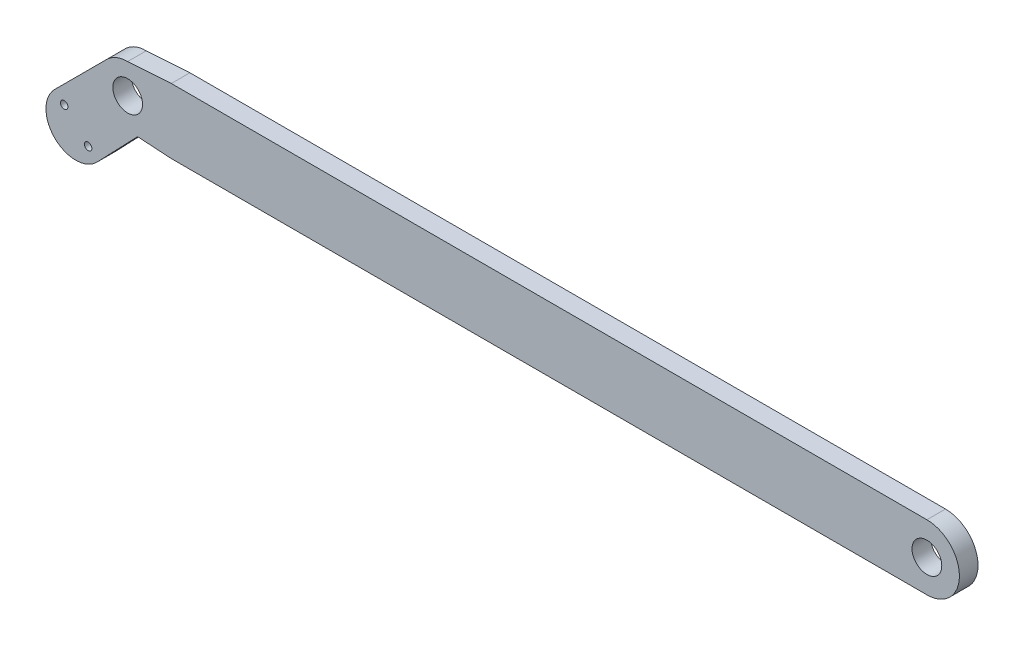
from build123d import *

# Parameters (mm, degrees)
SKETCH_3_R          = 8
EXTRUDE_1_DEPTH     = 5
SKETCH_4_R          = 4
CUT_EXTRUDE_1_DEPTH = 213.248558243
SKETCH_5_R          = 1
EXTRUDE_3_DEPTH     = 5


with BuildPart() as part:
    # 草图3 → 凸台-拉伸1 (new body)
    with BuildSketch(Plane.XY):
        with BuildLine():
            ThreePointArc((203.259167971, -8.750002099), (194.509167971, -2.099e-06), (203.259167971, 8.749997901))
            Line((203.259167971, 8.749997901), (0, 8.749997901))
            Line((0, 8.749997901), (-11.740832029, 8))
            ThreePointArc((-11.740832029, 8), (-6.08397778, 5.656854249), (-3.740832029, 0))
            ThreePointArc((-3.740832029, 0), (-6.08397778, -5.656854249), (-11.740832029, -8))
            Line((-11.740832029, -8), (0, -8.750038444))
            Line((0, -8.750038444), (203.259167971, -8.750002099))
        make_face()
        with Locations((-11.740832029, 0)):
            Circle(SKETCH_3_R)
        with BuildLine():
            ThreePointArc((212.009167971, -2.099e-06), (209.446352306, 6.187182236), (203.259167971, 8.749997901))
            Line((203.259167971, 8.749997901), (203.259167971, -8.750002099))
            ThreePointArc((203.259167971, -8.750002099), (209.446352306, -6.187186435), (212.009167971, -2.099e-06))
        make_face()
        with BuildLine():
            Line((203.259167971, -8.750002099), (203.259167971, 8.749997901))
            ThreePointArc((203.259167971, 8.749997901), (194.509167971, -2.099e-06), (203.259167971, -8.750002099))
        make_face()
    extrude(amount=EXTRUDE_1_DEPTH)

    # 草图4 → 切除-拉伸1 (cut, through all)
    with BuildSketch(Plane.XY.offset(5)):
        with Locations((-11.740832029, 0)):
            Circle(SKETCH_4_R)
        with Locations((203.259167971, -2.099e-06)):
            Circle(SKETCH_4_R)
    extrude(amount=-CUT_EXTRUDE_1_DEPTH, mode=Mode.SUBTRACT)

    # 草图5 → 凸台-拉伸3 (add)
    with BuildSketch(Plane.XY):
        with BuildLine():
            ThreePointArc((-11.740832029, -8), (-19.131223835, -3.063022848), (-17.400066767, 5.654472759))
            Line((-17.400066767, 5.654472759), (-31.381865156, -8.327324627))
            ThreePointArc((-31.381865156, -8.327324627), (-31.320161123, -19.702071726), (-19.94675289, -19.516966077))
            Line((-19.94675289, -19.516966077), (-9.081705309, -8.169872737))
            Line((-9.081705309, -8.169872737), (-11.740832029, -8))
        make_face()
        with Locations((-28.81851625, -10.634029839)):
            Circle(SKETCH_5_R, mode=Mode.SUBTRACT)
        with Locations((-22.374861868, -17.077684221)):
            Circle(SKETCH_5_R, mode=Mode.SUBTRACT)
    extrude(amount=EXTRUDE_3_DEPTH)


solid = part.part
